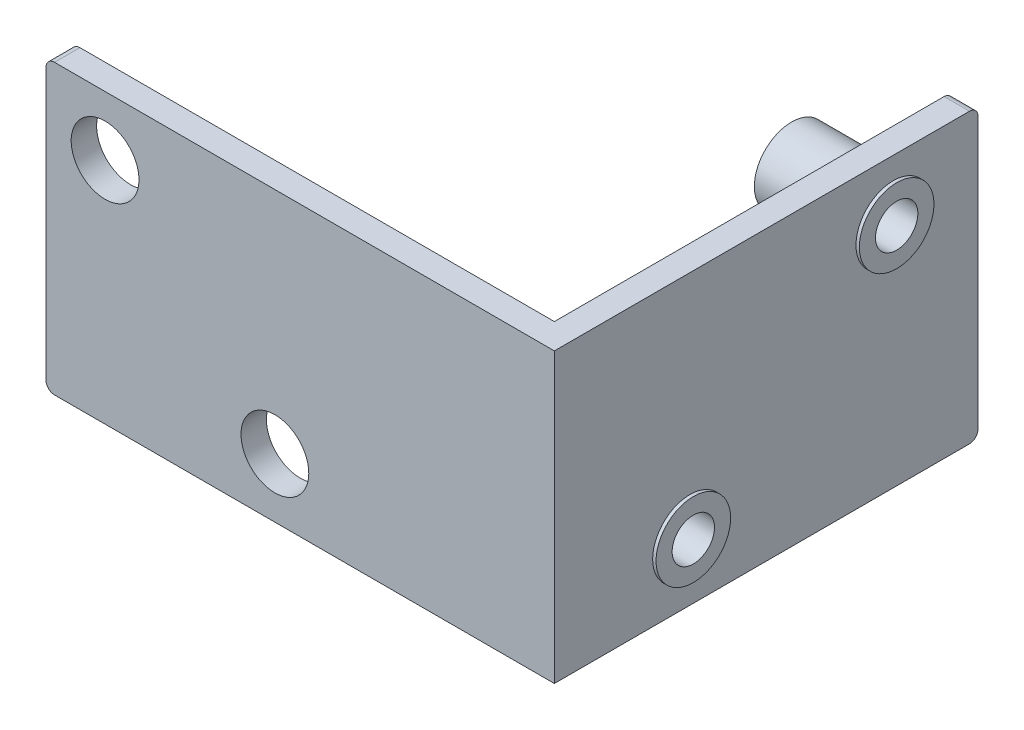
from build123d import *

# Parameters (mm, degrees)
ESQUISSE1_W             = 30
ESQUISSE1_H             = 17
EXTRUSION1_DEPTH        = 1.5
ESQUISSE2_R             = 2
ENL_V_MAT_EXTRU_1_DEPTH = 2
ESQUISSE3_W             = 1.5
ESQUISSE3_H             = 17
EXTRUSION2_DEPTH        = 23.5
ESQUISSE4_R             = 1.25
ENL_V_MAT_EXTRU_2_DEPTH = 2
EXTRUSION3_DEPTH        = 0.2
EXTRUSION3_DEPTH_BACK   = 6
ESQUISSE5_R             = 2.2
ESQUISSE5_R_2           = 1.25
CONG_1_R                = 0.5


with BuildPart() as part:
    # Esquisse1 → Extrusion1 (new body)
    with BuildSketch(Plane.XY):
        with Locations((6.051065449, -10.06674277)):
            Rectangle(ESQUISSE1_W, ESQUISSE1_H)
    extrude(amount=EXTRUSION1_DEPTH)

    # Esquisse2 → Enlèv. mat.-Extru.1 (cut)
    with BuildSketch(Plane.XY.offset(1.5)):
        with Locations((-5.463077382, -5.076163116)):
            Circle(ESQUISSE2_R)
        with Locations((4.558431294, -15.07006433)):
            Circle(ESQUISSE2_R)
    extrude(amount=-ENL_V_MAT_EXTRU_1_DEPTH, mode=Mode.SUBTRACT)

    # Esquisse3 → Extrusion2 (add)
    with BuildSketch(Plane(origin=(0, 0, 0), x_dir=(-1, 0, 0), z_dir=(0, 0, -1))):
        with Locations((-20.301065449, -10.06674277)):
            Rectangle(ESQUISSE3_W, ESQUISSE3_H)
    extrude(amount=EXTRUSION2_DEPTH)

    # Esquisse4 → Enlèv. mat.-Extru.2 (cut)
    with BuildSketch(Plane(origin=(21.051065449, 0, 0), x_dir=(0, 0, -1), z_dir=(1, 0, 0))):
        with Locations((6.5, -15.107440586)):
            Circle(ESQUISSE4_R)
        with Locations((18.5, -5.06674277)):
            Circle(ESQUISSE4_R)
    extrude(amount=-ENL_V_MAT_EXTRU_2_DEPTH, mode=Mode.SUBTRACT)

    # Esquisse5 → Extrusion3 (add, two sides: drawn at the far end of the back side and taken through both)
    # profile 1 of 2: a face of its own
    with BuildSketch(Plane(origin=(21.051065449, 0, 0), x_dir=(0, 0, -1), z_dir=(1, 0, 0)).offset(-EXTRUSION3_DEPTH_BACK)):
        with Locations(Location((6.5, -15.107440586, 0), (0, 0, 90))):
            Circle(ESQUISSE5_R)
        with Locations((6.5, -15.107440586)):
            Circle(ESQUISSE5_R_2, mode=Mode.SUBTRACT)
    # profile 2 of 2: a face of its own
    with BuildSketch(Plane(origin=(21.051065449, 0, 0), x_dir=(0, 0, -1), z_dir=(1, 0, 0)).offset(-EXTRUSION3_DEPTH_BACK)):
        with Locations(Location((18.5, -5.06674277, 0), (0, 0, 90))):
            Circle(ESQUISSE5_R)
        with Locations((18.5, -5.06674277)):
            Circle(ESQUISSE5_R_2, mode=Mode.SUBTRACT)
    extrude(amount=EXTRUSION3_DEPTH + EXTRUSION3_DEPTH_BACK)

    # Congé1
    cong_1_edges = [part.edges().sort_by_distance(p)[0] for p in [
        (20.301065449, -18.56674277, -23.5),
        (20.301065449, -1.56674277, -23.5),
        (-8.948934551, -18.56674277, 0.75),
        (-8.948934551, -1.56674277, 0.75),
    ]]
    fillet(cong_1_edges, radius=CONG_1_R)


solid = part.part
